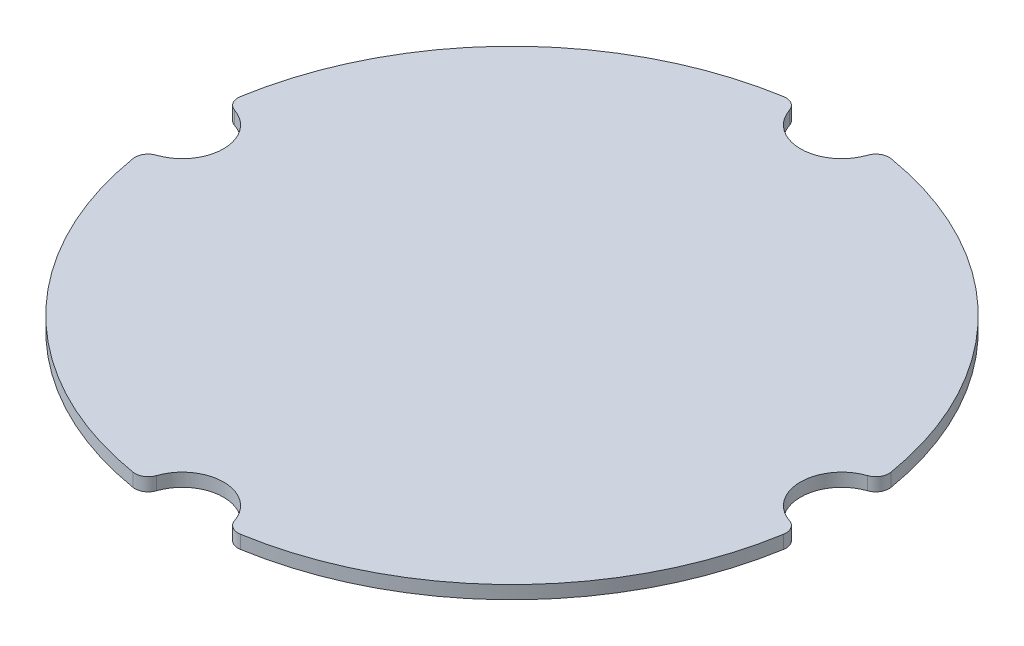
from build123d import *

# Parameters (mm, degrees)
SKETCH3_R                = 63.5
BOSS_EXTRUDE1_DEPTH      = 2.54
CUT_EXTRUDE1_REACH       = 91.838
SKETCH4_R                = 7.9375
FILLET1_R                = 2.54
CIRPATTERN1_COUNT        = 4
FILLET1_OF_CIRPATTERN1_R = 2.54


with BuildPart() as part:
    # Sketch3 → Boss-Extrude1 (new body)
    with BuildSketch(Plane(origin=(0, 0, 0), x_dir=(1, 0, 0), z_dir=(0, 1, 0))):
        with Locations(Location((0, 0, 0), (0, 0, 270))):
            Circle(SKETCH3_R)
    extrude(amount=BOSS_EXTRUDE1_DEPTH)

    # Sketch4 → Cut-Extrude1 (cut, up to next)
    with BuildSketch(Plane(origin=(0, 2.54, 0), x_dir=(1, 0, 0), z_dir=(0, 1, 0)), mode=Mode.PRIVATE) as cut_extrude1_sk1:
        with Locations((0, 63.5)):
            Circle(SKETCH4_R)
    cut_extrude1_tool1 = extrude(cut_extrude1_sk1.sketch, amount=-CUT_EXTRUDE1_REACH, mode=Mode.PRIVATE) & part.part
    cut_extrude1 = cut_extrude1_tool1.solids().sort_by_distance((0, 2.54, -63.5))[0]
    add(cut_extrude1, mode=Mode.SUBTRACT)

    # Fillet1
    fillet1_edges = [part.edges().sort_by_distance(p)[0] for p in [
        (7.921981901, 1.27, -63.00390625),
        (-7.921981901, 1.27, -63.00390625),
    ]]
    fillet(fillet1_edges, radius=FILLET1_R)

    # CirPattern1: Cut-Extrude1 ×4 about axis
    cirpattern1_axis = Axis((0, 0, 0), (0, 1, 0))
    for i in range(1, CIRPATTERN1_COUNT):
        add(cut_extrude1.rotate(cirpattern1_axis, i * 360 / CIRPATTERN1_COUNT), mode=Mode.SUBTRACT)

    # Fillet1 of CirPattern1
    fillet1_of_cirpattern1_edges = [part.edges().sort_by_distance(p)[0] for p in [
        (-63.00390625, 1.27, -7.921981901),
        (-63.00390625, 1.27, 7.921981901),
        (-7.921981901, 1.27, 63.00390625),
        (7.921981901, 1.27, 63.00390625),
        (63.00390625, 1.27, 7.921981901),
        (63.00390625, 1.27, -7.921981901),
    ]]
    fillet(fillet1_of_cirpattern1_edges, radius=FILLET1_OF_CIRPATTERN1_R)


solid = part.part
